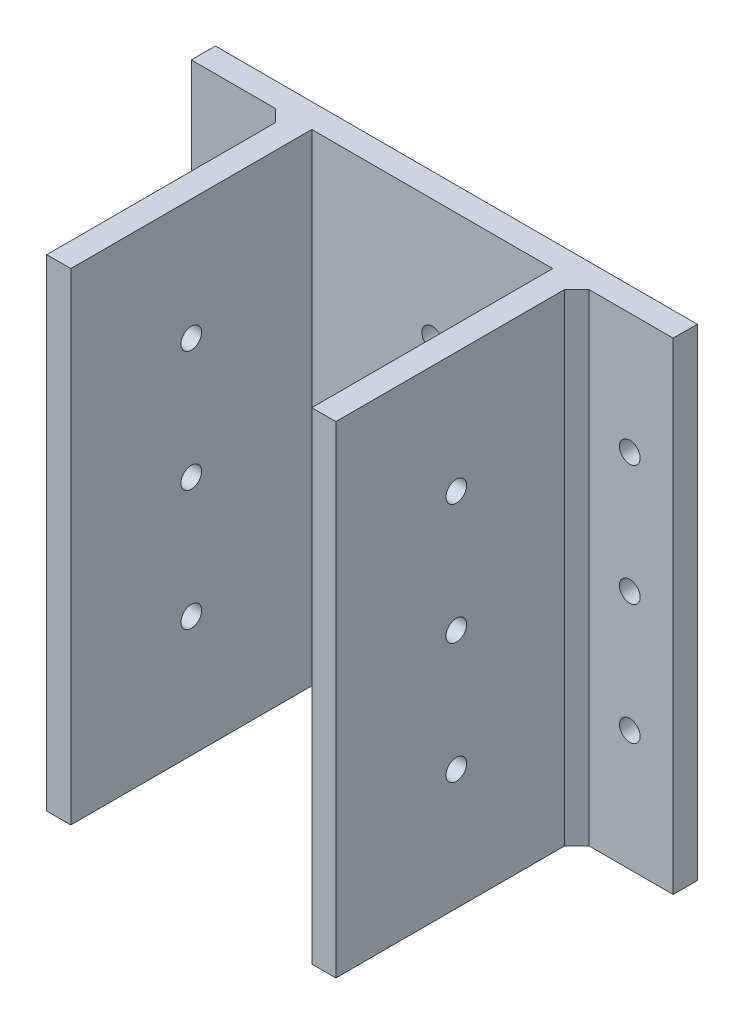
from build123d import *

# Parameters (mm, degrees)
SKETCH1_W               = 100
SKETCH1_H               = 100
BOSS_EXTRUDE1_DEPTH     = 5
SKETCH2_W               = 5
SKETCH2_H               = 100
BOSS_EXTRUDE2_DEPTH     = 50
SKETCH3_R               = 2.15
CUT_EXTRUDE1_DEPTH      = 10
LPATTERN1_COUNT         = 3
LPATTERN1_PITCH         = 25
MIRROR2_COPY_1_SKETCH_R = 2.15
MIRROR2_COPY_1_DEPTH    = 10
MIRROR2_COPY_2_SKETCH_R = 2.15
MIRROR2_COPY_2_DEPTH    = 10
MIRROR3_COPY_1_SKETCH_R = 2.15
MIRROR3_COPY_1_DEPTH    = 10
MIRROR3_COPY_2_SKETCH_R = 2.15
MIRROR3_COPY_2_DEPTH    = 10
MIRROR3_COPY_3_SKETCH_R = 2.15
MIRROR3_COPY_3_DEPTH    = 10
MIRROR3_COPY_4_SKETCH_R = 2.15
MIRROR3_COPY_4_DEPTH    = 10
CHAMFER1_SIZE           = 2.5
SKETCH7_R               = 2.15
CUT_EXTRUDE2_DEPTH      = 60
SKETCH8_R               = 2.15
CUT_EXTRUDE3_DEPTH      = 60


with BuildPart() as part:
    # Sketch1 → Boss-Extrude1 (new body)
    with BuildSketch(Plane.XY):
        Rectangle(SKETCH1_W, SKETCH1_H)
    extrude(amount=BOSS_EXTRUDE1_DEPTH)

    # Sketch2 → Boss-Extrude2 (add)
    with BuildSketch(Plane.XY.offset(5)):
        with Locations((27.5, 0)):
            Rectangle(SKETCH2_W, SKETCH2_H)
    boss_extrude2 = extrude(amount=BOSS_EXTRUDE2_DEPTH)

    # Sketch3 → Cut-Extrude1 (cut)
    with BuildSketch(Plane(origin=(0, 0, 0), x_dir=(-1, 0, 0), z_dir=(0, 0, -1))):
        with Locations((0, 25)):
            Circle(SKETCH3_R)
    cut_extrude1 = extrude(amount=-CUT_EXTRUDE1_DEPTH, mode=Mode.SUBTRACT)

    # Mirror1: Boss-Extrude2 across plane
    add(boss_extrude2.mirror(Plane(origin=(0, 0, 0), x_dir=(0, 0, 1), z_dir=(1, 0, 0))))

    # LPattern1: Cut-Extrude1 ×3
    with Locations(*[(0, -i * LPATTERN1_PITCH, 0) for i in range(1, LPATTERN1_COUNT)]):
        add(cut_extrude1, mode=Mode.SUBTRACT)

    # Mirror2: Cut-Extrude1 across plane
    add(cut_extrude1.mirror(Plane(origin=(20.5, 0, 0), x_dir=(0, 0, 1), z_dir=(1, 0, 0))), mode=Mode.SUBTRACT)

    # Mirror2 copy 1 sketch → Mirror2 copy 1 (cut)
    with BuildSketch(Plane(origin=(41, -25, 0), x_dir=(1, 0, 0), z_dir=(0, 0, -1))):
        with Locations((0, -25)):
            Circle(MIRROR2_COPY_1_SKETCH_R)
    extrude(amount=-MIRROR2_COPY_1_DEPTH, mode=Mode.SUBTRACT)

    # Mirror2 copy 2 sketch → Mirror2 copy 2 (cut)
    with BuildSketch(Plane(origin=(41, -50, 0), x_dir=(1, 0, 0), z_dir=(0, 0, -1))):
        with Locations((0, -25)):
            Circle(MIRROR2_COPY_2_SKETCH_R)
    extrude(amount=-MIRROR2_COPY_2_DEPTH, mode=Mode.SUBTRACT)

    # Mirror3 copy 1 sketch → Mirror3 copy 1 (cut)
    with BuildSketch(Plane(origin=(-41, 0, 0), x_dir=(-1, 0, 0), z_dir=(0, 0, -1))):
        with Locations((0, 25)):
            Circle(MIRROR3_COPY_1_SKETCH_R)
    extrude(amount=-MIRROR3_COPY_1_DEPTH, mode=Mode.SUBTRACT)

    # Mirror3 copy 2 sketch → Mirror3 copy 2 (cut)
    with BuildSketch(Plane(origin=(-41, -25, 0), x_dir=(-1, 0, 0), z_dir=(0, 0, -1))):
        with Locations((0, 25)):
            Circle(MIRROR3_COPY_2_SKETCH_R)
    extrude(amount=-MIRROR3_COPY_2_DEPTH, mode=Mode.SUBTRACT)

    # Mirror3 copy 3 sketch → Mirror3 copy 3 (cut)
    with BuildSketch(Plane(origin=(-41, -50, 0), x_dir=(-1, 0, 0), z_dir=(0, 0, -1))):
        with Locations((0, 25)):
            Circle(MIRROR3_COPY_3_SKETCH_R)
    extrude(amount=-MIRROR3_COPY_3_DEPTH, mode=Mode.SUBTRACT)

    # Mirror3 copy 4 sketch → Mirror3 copy 4 (cut)
    with BuildSketch(Plane(origin=(0, 0, 0), x_dir=(1, 0, 0), z_dir=(0, 0, -1))):
        with Locations((0, -25)):
            Circle(MIRROR3_COPY_4_SKETCH_R)
    extrude(amount=-MIRROR3_COPY_4_DEPTH, mode=Mode.SUBTRACT)

    # Chamfer1
    chamfer1_edges = [part.edges().sort_by_distance(p)[0] for p in [
        (30, 0, 5),
        (-30, 0, 5),
    ]]
    chamfer(chamfer1_edges, length=CHAMFER1_SIZE)

    # Sketch7 → Cut-Extrude2 (cut)
    with BuildSketch(Plane.ZY.offset(30)):
        with Locations(Location((30, 25, 0), (0, 0, 270))):
            Circle(SKETCH7_R)
    cut_extrude2 = extrude(amount=-CUT_EXTRUDE2_DEPTH, mode=Mode.SUBTRACT)

    # Sketch8 → Cut-Extrude3 (cut)
    with BuildSketch(Plane.ZY.offset(30)):
        with Locations(Location((30, 0, 0), (0, 0, 270))):
            Circle(SKETCH8_R)
        with Locations(Location((30, 25, 0), (0, 0, 270))):
            Circle(SKETCH8_R)
    extrude(amount=-CUT_EXTRUDE3_DEPTH, mode=Mode.SUBTRACT)

    # Mirror4: Cut-Extrude2 across plane
    add(cut_extrude2.mirror(Plane.ZX), mode=Mode.SUBTRACT)


solid = part.part
